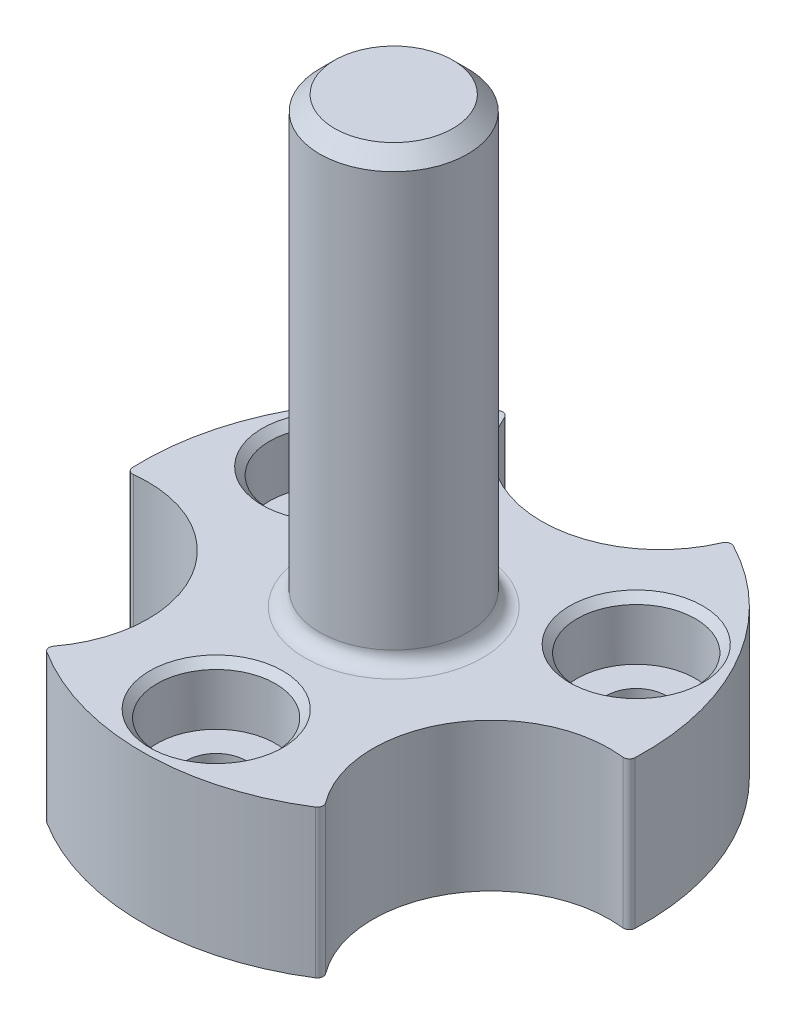
from build123d import *

# Parameters (mm, degrees)
CUT_EXTRUDE1_REACH = 25.335
SKETCH2_R          = 4
SKETCH2_R_2        = 1
FILLET1_R          = 0.2
SKETCH3_R          = 2
CUT_EXTRUDE2_DEPTH = 2
CHAMFER1_SIZE      = 0.25


with BuildPart() as part:
    # Sketch1 → Revolve1 (revolve)
    with BuildSketch(Plane.XY, mode=Mode.PRIVATE) as revolve1_sk:
        with BuildLine():
            Line((4.6, 0), (8.5, 0))
            Line((8.5, 0), (8.5, 5))
            Line((8.5, 5), (3, 5))
            ThreePointArc((3, 5), (2.646446609, 5.146446609), (2.5, 5.5))
            Line((2.5, 5.5), (2.5, 19.5))
            Line((2.5, 19.5), (2, 20))
            Line((2, 20), (0, 20))
            Line((0, 20), (0, 2))
            Line((0, 2), (4.5, 2))
            Line((4.5, 2), (4.5, 0.1))
            Line((4.5, 0.1), (4.6, 0))
        make_face()
    revolve(revolve1_sk.sketch.rotate(Axis((0, 20, 0), (0, -1, 0)), 90), axis=Axis((0, 20, 0), (0, -1, 0)))

    # Sketch2 → Cut-Extrude1 (cut, up to next)
    with BuildSketch(Plane.XZ, mode=Mode.PRIVATE) as cut_extrude1_sk1:
        with Locations((7.794228634, 4.5)):
            Circle(SKETCH2_R)
    cut_extrude1_tool1 = extrude(cut_extrude1_sk1.sketch, amount=-CUT_EXTRUDE1_REACH, mode=Mode.PRIVATE) & part.part
    # Sketch2 → Cut-Extrude1 (cut, up to next)
    with BuildSketch(Plane.XZ, mode=Mode.PRIVATE) as cut_extrude1_sk2:
        with Locations(Location((0, 6, 0), (0, 0, 270))):
            Circle(SKETCH2_R_2)
    cut_extrude1_tool2 = extrude(cut_extrude1_sk2.sketch, amount=-CUT_EXTRUDE1_REACH, mode=Mode.PRIVATE) & part.part
    # Sketch2 → Cut-Extrude1 (cut, up to next)
    with BuildSketch(Plane.XZ, mode=Mode.PRIVATE) as cut_extrude1_sk3:
        with Locations(Location((5.196152423, -3, 0), (0, 0, 270))):
            Circle(SKETCH2_R_2)
    cut_extrude1_tool3 = extrude(cut_extrude1_sk3.sketch, amount=-CUT_EXTRUDE1_REACH, mode=Mode.PRIVATE) & part.part
    # Sketch2 → Cut-Extrude1 (cut, up to next)
    with BuildSketch(Plane.XZ, mode=Mode.PRIVATE) as cut_extrude1_sk4:
        with Locations((0, -9)):
            Circle(SKETCH2_R)
    cut_extrude1_tool4 = extrude(cut_extrude1_sk4.sketch, amount=-CUT_EXTRUDE1_REACH, mode=Mode.PRIVATE) & part.part
    # Sketch2 → Cut-Extrude1 (cut, up to next)
    with BuildSketch(Plane.XZ, mode=Mode.PRIVATE) as cut_extrude1_sk5:
        with Locations(Location((-5.196152423, -3, 0), (0, 0, 270))):
            Circle(SKETCH2_R_2)
    cut_extrude1_tool5 = extrude(cut_extrude1_sk5.sketch, amount=-CUT_EXTRUDE1_REACH, mode=Mode.PRIVATE) & part.part
    # Sketch2 → Cut-Extrude1 (cut, up to next)
    with BuildSketch(Plane.XZ, mode=Mode.PRIVATE) as cut_extrude1_sk6:
        with Locations((-7.794228634, 4.5)):
            Circle(SKETCH2_R)
    cut_extrude1_tool6 = extrude(cut_extrude1_sk6.sketch, amount=-CUT_EXTRUDE1_REACH, mode=Mode.PRIVATE) & part.part
    add(cut_extrude1_tool1.solids().sort_by_distance((7.794229, 0, 4.5))[0], mode=Mode.SUBTRACT)
    add(cut_extrude1_tool2.solids().sort_by_distance((0, 0, 6))[0], mode=Mode.SUBTRACT)
    add(cut_extrude1_tool3.solids().sort_by_distance((5.196152, 0, -3))[0], mode=Mode.SUBTRACT)
    add(cut_extrude1_tool4.solids().sort_by_distance((0, 0, -9))[0], mode=Mode.SUBTRACT)
    add(cut_extrude1_tool5.solids().sort_by_distance((-5.196152, 0, -3))[0], mode=Mode.SUBTRACT)
    add(cut_extrude1_tool6.solids().sort_by_distance((-7.794229, 0, 4.5))[0], mode=Mode.SUBTRACT)

    # Fillet1
    fillet1_edges = [part.edges().sort_by_distance(p)[0] for p in [
        (8.481566104, 2.5, 0.55949658),
        (4.725321304, 2.5, 7.06550342),
        (-3.7562448, 2.5, -7.625),
        (3.7562448, 2.5, -7.625),
        (-4.725321304, 2.5, 7.06550342),
        (-8.481566104, 2.5, 0.55949658),
    ]]
    fillet(fillet1_edges, radius=FILLET1_R)

    # Sketch3 → Cut-Extrude2 (cut)
    with BuildSketch(Plane(origin=(0, 5, 0), x_dir=(1, 0, 0), z_dir=(0, 1, 0))):
        with Locations(Location((0, -6, 0), (0, 0, 270))):
            Circle(SKETCH3_R)
        with Locations(Location((-5.196152423, 3, 0), (0, 0, 270))):
            Circle(SKETCH3_R)
        with Locations(Location((5.196152423, 3, 0), (0, 0, 270))):
            Circle(SKETCH3_R)
    extrude(amount=-CUT_EXTRUDE2_DEPTH, mode=Mode.SUBTRACT)

    # Chamfer1
    chamfer1_edges = [part.edges().sort_by_distance(p)[0] for p in [
        (-5.196152423, 5, -5),
        (5.196152423, 5, -5),
        (0, 5, 4),
    ]]
    chamfer(chamfer1_edges, length=CHAMFER1_SIZE)


solid = part.part
